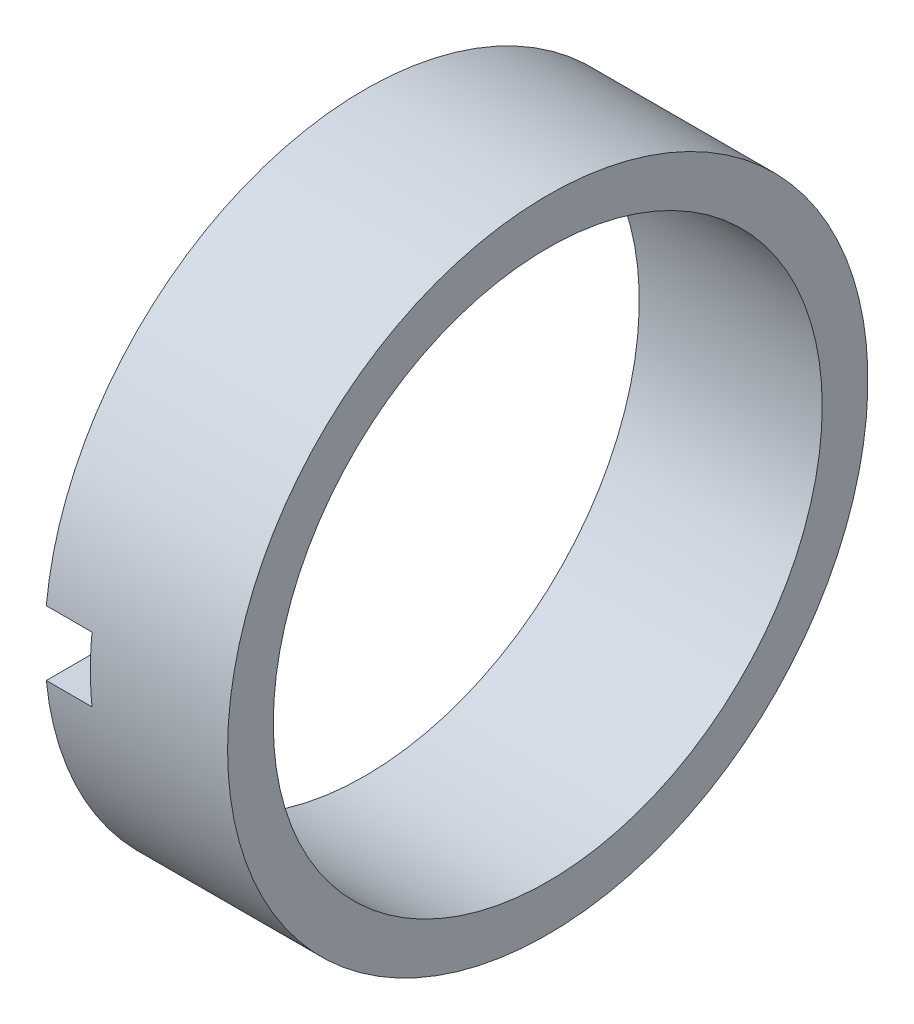
from build123d import *

# Parameters (mm, degrees)
SKETCH1_W          = 19.0246
SKETCH1_H          = 76.2
SKETCH2_W          = 26.9748
SKETCH2_H          = 266.7
CUT_EXTRUDE2_DEPTH = 19.05


with BuildPart() as part:
    # Sketch1 → Revolve1 (revolve)
    with BuildSketch(Plane(origin=(0, 0, 0), x_dir=(0, 1, 0), z_dir=(0, 0, 1)), mode=Mode.PRIVATE) as revolve1_sk:
        with Locations((123.8377, -38.1)):
            Rectangle(SKETCH1_W, SKETCH1_H)
    revolve(revolve1_sk.sketch.rotate(Axis((-25.4, 0, 0), (1, 0, 0)), 90), axis=Axis((-25.4, 0, 0), (1, 0, 0)))

    # Sketch2 → Cut-Extrude2 (cut)
    with BuildSketch(Plane.YZ):
        with Locations((0, 133.35)):
            Rectangle(SKETCH2_W, SKETCH2_H)
    extrude(amount=CUT_EXTRUDE2_DEPTH, mode=Mode.SUBTRACT)


solid = part.part
